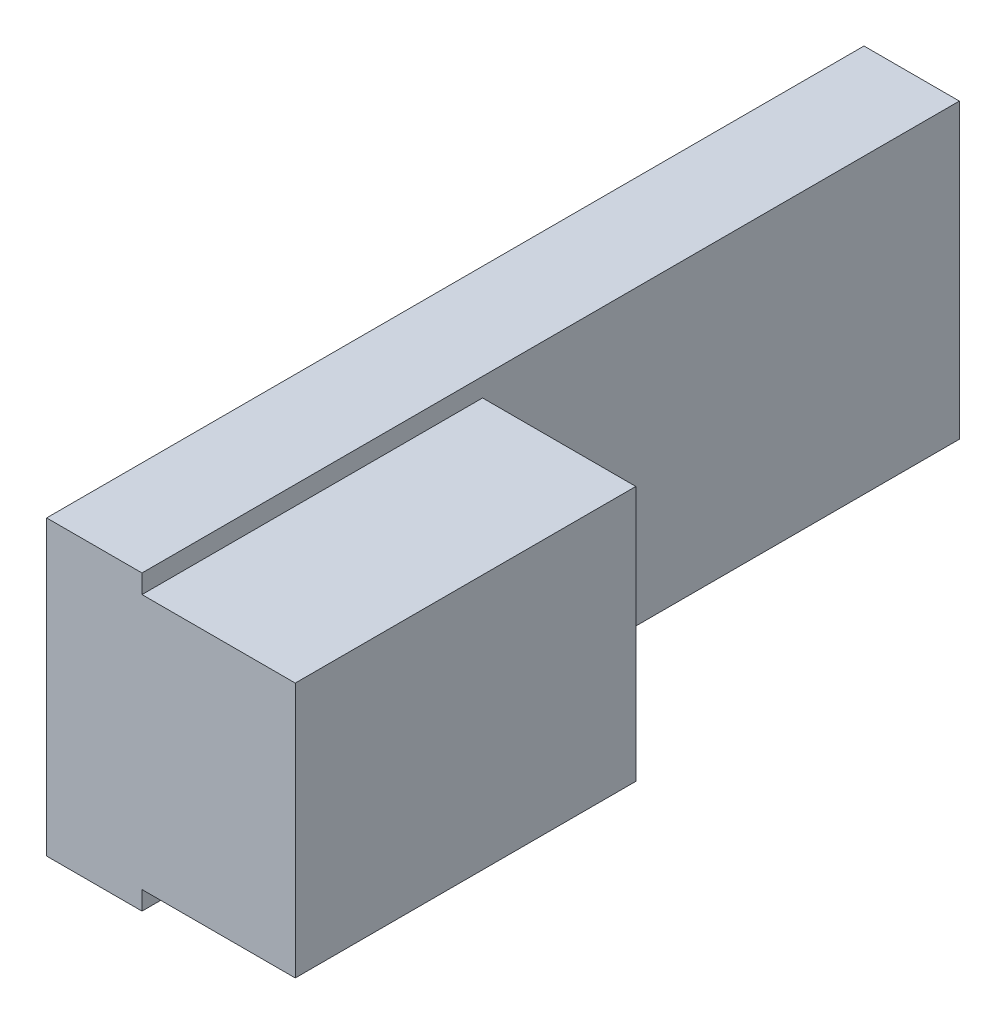
from build123d import *

# Parameters (mm, degrees)
SKETCH_1_W      = 17.2
SKETCH_1_H      = 48
EXTRUDE_1_DEPTH = 5.6
SKETCH_2_W      = 20
SKETCH_2_H      = 15
EXTRUDE_2_DEPTH = 9


with BuildPart() as part:
    # 草图1 → 凸台-拉伸1 (new body)
    with BuildSketch(Plane(origin=(0, 0, 0), x_dir=(0, -1, 0), z_dir=(-1, 0, 0))):
        Rectangle(SKETCH_1_W, SKETCH_1_H)
    extrude(amount=-EXTRUDE_1_DEPTH)

    # 草图2 → 凸台-拉伸2 (add)
    with BuildSketch(Plane(origin=(5.6, 0, 0), x_dir=(0, 0, -1), z_dir=(1, 0, 0))):
        with Locations((-14, 0)):
            Rectangle(SKETCH_2_W, SKETCH_2_H)
    extrude(amount=EXTRUDE_2_DEPTH)


solid = part.part
